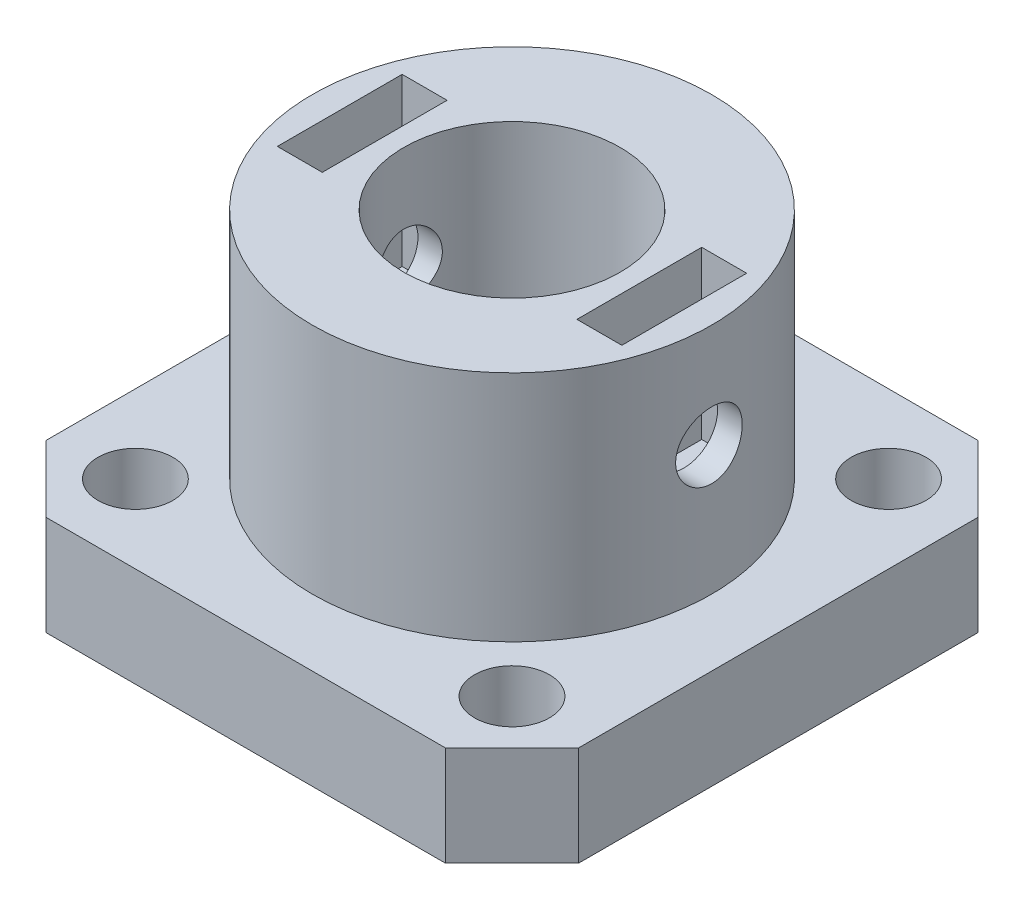
from build123d import *

# Parameters (mm, degrees)
SKETCH1_R               = 12
SKETCH1_R_2             = 6.5
BOSS_EXTRUDE1_DEPTH     = 20
SKETCH2_W               = 32
SKETCH2_H               = 32
SKETCH2_R               = 6.5
BOSS_EXTRUDE2_DEPTH     = 6
SKETCH3_R               = 2.25
CUT_EXTRUDE1_DEPTH      = 31.199337741
CHAMFER1_SIZE           = 4
CUT_EXTRUDE2_START      = 20
SKETCH4_W               = 2.7
SKETCH4_H               = 7.5
CUT_EXTRUDE2_DEPTH      = 10
CUT_EXTRUDE3_DEPTH      = 31.199337741
CUT_EXTRUDE3_DEPTH_BACK = 31.199337741
SKETCH5_R               = 2


with BuildPart() as part:
    # Sketch1 → Boss-Extrude1 (new body)
    with BuildSketch(Plane(origin=(0, 0, 0), x_dir=(1, 0, 0), z_dir=(0, 1, 0))):
        with Locations(Location((0, 0, 0), (0, 0, 270))):
            Circle(SKETCH1_R)
        with Locations(Location((0, 0, 0), (0, 0, 270))):
            Circle(SKETCH1_R_2, mode=Mode.SUBTRACT)
    extrude(amount=BOSS_EXTRUDE1_DEPTH)

    # Sketch2 → Boss-Extrude2 (add)
    with BuildSketch(Plane(origin=(0, 0, 0), x_dir=(1, 0, 0), z_dir=(0, 1, 0))):
        Rectangle(SKETCH2_W, SKETCH2_H)
        with Locations(Location((0, 0, 0), (0, 0, 270))):
            Circle(SKETCH2_R, mode=Mode.SUBTRACT)
    extrude(amount=BOSS_EXTRUDE2_DEPTH)

    # Sketch3 → Cut-Extrude1 (cut, through all)
    with BuildSketch(Plane(origin=(0, 0, 0), x_dir=(1, 0, 0), z_dir=(0, 1, 0))):
        with Locations(Location((-11.313708499, 11.313708499, 0), (0, 0, 270))):
            Circle(SKETCH3_R)
        with Locations(Location((-11.313708499, -11.313708499, 0), (0, 0, 270))):
            Circle(SKETCH3_R)
        with Locations(Location((11.313708499, -11.313708499, 0), (0, 0, 270))):
            Circle(SKETCH3_R)
        with Locations(Location((11.313708499, 11.313708499, 0), (0, 0, 270))):
            Circle(SKETCH3_R)
    extrude(amount=CUT_EXTRUDE1_DEPTH, mode=Mode.SUBTRACT)

    # Chamfer1
    chamfer1_edges = [part.edges().sort_by_distance(p)[0] for p in [
        (16, 3, 16),
        (16, 3, -16),
        (-16, 3, -16),
        (-16, 3, 16),
    ]]
    chamfer(chamfer1_edges, length=CHAMFER1_SIZE)

    # Sketch4 → Cut-Extrude2 (cut)
    with BuildSketch(Plane(origin=(0, 0, 0), x_dir=(1, 0, 0), z_dir=(0, 1, 0)).offset(CUT_EXTRUDE2_START)):
        with Locations((-9, 0)):
            Rectangle(SKETCH4_W, SKETCH4_H)
    cut_extrude2 = extrude(amount=-CUT_EXTRUDE2_DEPTH, mode=Mode.SUBTRACT)

    # Sketch5 → Cut-Extrude3 (cut, two sides: drawn at the far end of the back side and taken through both)
    with BuildSketch(Plane(origin=(0, 0, 0), x_dir=(0, 0, -1), z_dir=(1, 0, 0)).offset(-CUT_EXTRUDE3_DEPTH_BACK)):
        with Locations((0, 13.75)):
            Circle(SKETCH5_R)
    extrude(amount=CUT_EXTRUDE3_DEPTH + CUT_EXTRUDE3_DEPTH_BACK, mode=Mode.SUBTRACT)

    # Mirror1: Cut-Extrude2 across plane
    add(cut_extrude2.mirror(Plane(origin=(0, 0, 0), x_dir=(0, 0, 1), z_dir=(1, 0, 0))), mode=Mode.SUBTRACT)


solid = part.part
